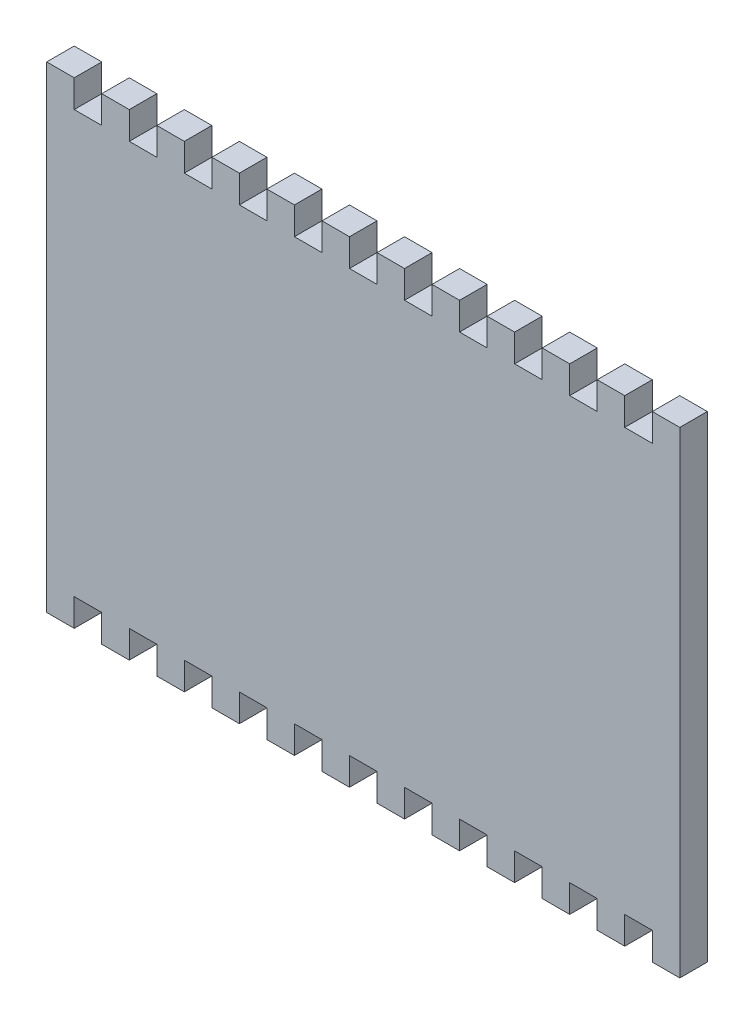
from build123d import *

# Parameters (mm, degrees)
SKETCH1_W                = 150
SKETCH1_H                = 55
BOSS_EXTRUDE1_DEPTH      = 3.175
CUT_EXTRUDE1_REACH       = 81.946
SKETCH2_W                = 3.175
SKETCH2_H                = 6.35
LPATTERN1_COUNT          = 12
LPATTERN1_PITCH          = 6.35
LPATTERN1_COL_COUNT      = 12
LPATTERN1_COL_PITCH      = 6.35
MIRROR1_COPY_1_REACH     = 81.946
MIRROR1_COPY_1_SKETCH_W  = 3.175
MIRROR1_COPY_1_SKETCH_H  = 6.35
MIRROR1_COPY_2_REACH     = 81.946
MIRROR1_COPY_2_SKETCH_W  = 3.175
MIRROR1_COPY_2_SKETCH_H  = 6.35
MIRROR1_COPY_3_REACH     = 81.946
MIRROR1_COPY_3_SKETCH_W  = 3.175
MIRROR1_COPY_3_SKETCH_H  = 6.35
MIRROR1_COPY_4_REACH     = 81.946
MIRROR1_COPY_4_SKETCH_W  = 3.175
MIRROR1_COPY_4_SKETCH_H  = 6.35
MIRROR1_COPY_5_REACH     = 81.946
MIRROR1_COPY_5_SKETCH_W  = 3.175
MIRROR1_COPY_5_SKETCH_H  = 6.35
MIRROR1_COPY_6_REACH     = 81.946
MIRROR1_COPY_6_SKETCH_W  = 3.175
MIRROR1_COPY_6_SKETCH_H  = 6.35
MIRROR1_COPY_7_REACH     = 81.946
MIRROR1_COPY_7_SKETCH_W  = 3.175
MIRROR1_COPY_7_SKETCH_H  = 6.35
MIRROR1_COPY_8_REACH     = 81.946
MIRROR1_COPY_8_SKETCH_W  = 3.175
MIRROR1_COPY_8_SKETCH_H  = 6.35
MIRROR1_COPY_9_REACH     = 81.946
MIRROR1_COPY_9_SKETCH_W  = 3.175
MIRROR1_COPY_9_SKETCH_H  = 6.35
MIRROR1_COPY_10_REACH    = 81.946
MIRROR1_COPY_10_SKETCH_W = 3.175
MIRROR1_COPY_10_SKETCH_H = 6.35
MIRROR1_COPY_11_REACH    = 81.946
MIRROR1_COPY_11_SKETCH_W = 3.175
MIRROR1_COPY_11_SKETCH_H = 6.35
MIRROR1_COPY_12_REACH    = 81.946
MIRROR1_COPY_12_SKETCH_W = 3.175
MIRROR1_COPY_12_SKETCH_H = 6.35
MIRROR1_COPY_13_REACH    = 81.946
MIRROR1_COPY_13_SKETCH_W = 3.175
MIRROR1_COPY_13_SKETCH_H = 6.35
MIRROR1_COPY_14_REACH    = 81.946
MIRROR1_COPY_14_SKETCH_W = 3.175
MIRROR1_COPY_14_SKETCH_H = 6.35
MIRROR1_COPY_15_REACH    = 81.946
MIRROR1_COPY_15_SKETCH_W = 3.175
MIRROR1_COPY_15_SKETCH_H = 6.35
MIRROR1_COPY_16_REACH    = 81.946
MIRROR1_COPY_16_SKETCH_W = 3.175
MIRROR1_COPY_16_SKETCH_H = 6.35
MIRROR1_COPY_17_REACH    = 81.946
MIRROR1_COPY_17_SKETCH_W = 3.175
MIRROR1_COPY_17_SKETCH_H = 6.35
MIRROR1_COPY_18_REACH    = 81.946
MIRROR1_COPY_18_SKETCH_W = 3.175
MIRROR1_COPY_18_SKETCH_H = 6.35
MIRROR1_COPY_19_REACH    = 81.946
MIRROR1_COPY_19_SKETCH_W = 3.175
MIRROR1_COPY_19_SKETCH_H = 6.35
MIRROR1_COPY_20_REACH    = 81.946
MIRROR1_COPY_20_SKETCH_W = 3.175
MIRROR1_COPY_20_SKETCH_H = 6.35
MIRROR1_COPY_21_REACH    = 81.946
MIRROR1_COPY_21_SKETCH_W = 3.175
MIRROR1_COPY_21_SKETCH_H = 6.35
MIRROR1_COPY_22_REACH    = 81.946
MIRROR1_COPY_22_SKETCH_W = 3.175
MIRROR1_COPY_22_SKETCH_H = 6.35
SKETCH3_W                = 19.4375
SKETCH3_H                = 55
CUT_EXTRUDE2_DEPTH       = 10
CUT_EXTRUDE3_DEPTH       = 10
SKETCH6_W                = 15.875
SKETCH6_H                = 3.175
CUT_EXTRUDE4_DEPTH       = 10
SKETCH7_W                = 19.05
SKETCH7_H                = 48.65
CUT_EXTRUDE5_DEPTH       = 10


with BuildPart() as part:
    # Sketch1 → Boss-Extrude1 (new body)
    with BuildSketch(Plane.XY):
        Rectangle(SKETCH1_W, SKETCH1_H)
    extrude(amount=BOSS_EXTRUDE1_DEPTH)

    # Sketch2 → Cut-Extrude1 (cut, up to next)
    with BuildSketch(Plane(origin=(0, 0, 0), x_dir=(-1, 0, 0), z_dir=(0, 0, -1)), mode=Mode.PRIVATE) as cut_extrude1_sk1:
        with Locations((0, 27.5)):
            Rectangle(SKETCH2_W, SKETCH2_H)
    cut_extrude1_tool1 = extrude(cut_extrude1_sk1.sketch, amount=-CUT_EXTRUDE1_REACH, mode=Mode.PRIVATE) & part.part
    cut_extrude1 = cut_extrude1_tool1.solids().sort_by_distance((0, 27.5, 0))[0]
    add(cut_extrude1, mode=Mode.SUBTRACT)

    # LPattern1: Cut-Extrude1 ×12
    with Locations(*[(i * LPATTERN1_PITCH, 0, 0) for i in range(1, LPATTERN1_COUNT)]):
        add(cut_extrude1, mode=Mode.SUBTRACT)

    # LPattern1 col: Cut-Extrude1 ×12
    with Locations(*[(-i * LPATTERN1_COL_PITCH, 0, 0) for i in range(1, LPATTERN1_COL_COUNT)]):
        add(cut_extrude1, mode=Mode.SUBTRACT)

    # Mirror1: Cut-Extrude1 across plane
    add(cut_extrude1.mirror(Plane.ZX), mode=Mode.SUBTRACT)

    # Mirror1 copy 1 sketch → Mirror1 copy 1 (cut, up to next)
    with BuildSketch(Plane(origin=(6.35, 0, 0), x_dir=(-1, 0, 0), z_dir=(0, 0, -1)), mode=Mode.PRIVATE) as mirror1_copy_1_sk1:
        with Locations((0, -27.5)):
            Rectangle(MIRROR1_COPY_1_SKETCH_W, MIRROR1_COPY_1_SKETCH_H)
    mirror1_copy_1_tool1 = extrude(mirror1_copy_1_sk1.sketch, amount=-MIRROR1_COPY_1_REACH, mode=Mode.PRIVATE) & part.part
    add(mirror1_copy_1_tool1.solids().sort_by_distance((6.35, -27.5, 0))[0], mode=Mode.SUBTRACT)

    # Mirror1 copy 2 sketch → Mirror1 copy 2 (cut, up to next)
    with BuildSketch(Plane(origin=(12.7, 0, 0), x_dir=(-1, 0, 0), z_dir=(0, 0, -1)), mode=Mode.PRIVATE) as mirror1_copy_2_sk1:
        with Locations((0, -27.5)):
            Rectangle(MIRROR1_COPY_2_SKETCH_W, MIRROR1_COPY_2_SKETCH_H)
    mirror1_copy_2_tool1 = extrude(mirror1_copy_2_sk1.sketch, amount=-MIRROR1_COPY_2_REACH, mode=Mode.PRIVATE) & part.part
    add(mirror1_copy_2_tool1.solids().sort_by_distance((12.7, -27.5, 0))[0], mode=Mode.SUBTRACT)

    # Mirror1 copy 3 sketch → Mirror1 copy 3 (cut, up to next)
    with BuildSketch(Plane(origin=(19.05, 0, 0), x_dir=(-1, 0, 0), z_dir=(0, 0, -1)), mode=Mode.PRIVATE) as mirror1_copy_3_sk1:
        with Locations((0, -27.5)):
            Rectangle(MIRROR1_COPY_3_SKETCH_W, MIRROR1_COPY_3_SKETCH_H)
    mirror1_copy_3_tool1 = extrude(mirror1_copy_3_sk1.sketch, amount=-MIRROR1_COPY_3_REACH, mode=Mode.PRIVATE) & part.part
    add(mirror1_copy_3_tool1.solids().sort_by_distance((19.05, -27.5, 0))[0], mode=Mode.SUBTRACT)

    # Mirror1 copy 4 sketch → Mirror1 copy 4 (cut, up to next)
    with BuildSketch(Plane(origin=(25.4, 0, 0), x_dir=(-1, 0, 0), z_dir=(0, 0, -1)), mode=Mode.PRIVATE) as mirror1_copy_4_sk1:
        with Locations((0, -27.5)):
            Rectangle(MIRROR1_COPY_4_SKETCH_W, MIRROR1_COPY_4_SKETCH_H)
    mirror1_copy_4_tool1 = extrude(mirror1_copy_4_sk1.sketch, amount=-MIRROR1_COPY_4_REACH, mode=Mode.PRIVATE) & part.part
    add(mirror1_copy_4_tool1.solids().sort_by_distance((25.4, -27.5, 0))[0], mode=Mode.SUBTRACT)

    # Mirror1 copy 5 sketch → Mirror1 copy 5 (cut, up to next)
    with BuildSketch(Plane(origin=(31.75, 0, 0), x_dir=(-1, 0, 0), z_dir=(0, 0, -1)), mode=Mode.PRIVATE) as mirror1_copy_5_sk1:
        with Locations((0, -27.5)):
            Rectangle(MIRROR1_COPY_5_SKETCH_W, MIRROR1_COPY_5_SKETCH_H)
    mirror1_copy_5_tool1 = extrude(mirror1_copy_5_sk1.sketch, amount=-MIRROR1_COPY_5_REACH, mode=Mode.PRIVATE) & part.part
    add(mirror1_copy_5_tool1.solids().sort_by_distance((31.75, -27.5, 0))[0], mode=Mode.SUBTRACT)

    # Mirror1 copy 6 sketch → Mirror1 copy 6 (cut, up to next)
    with BuildSketch(Plane(origin=(38.1, 0, 0), x_dir=(-1, 0, 0), z_dir=(0, 0, -1)), mode=Mode.PRIVATE) as mirror1_copy_6_sk1:
        with Locations((0, -27.5)):
            Rectangle(MIRROR1_COPY_6_SKETCH_W, MIRROR1_COPY_6_SKETCH_H)
    mirror1_copy_6_tool1 = extrude(mirror1_copy_6_sk1.sketch, amount=-MIRROR1_COPY_6_REACH, mode=Mode.PRIVATE) & part.part
    add(mirror1_copy_6_tool1.solids().sort_by_distance((38.1, -27.5, 0))[0], mode=Mode.SUBTRACT)

    # Mirror1 copy 7 sketch → Mirror1 copy 7 (cut, up to next)
    with BuildSketch(Plane(origin=(44.45, 0, 0), x_dir=(-1, 0, 0), z_dir=(0, 0, -1)), mode=Mode.PRIVATE) as mirror1_copy_7_sk1:
        with Locations((0, -27.5)):
            Rectangle(MIRROR1_COPY_7_SKETCH_W, MIRROR1_COPY_7_SKETCH_H)
    mirror1_copy_7_tool1 = extrude(mirror1_copy_7_sk1.sketch, amount=-MIRROR1_COPY_7_REACH, mode=Mode.PRIVATE) & part.part
    add(mirror1_copy_7_tool1.solids().sort_by_distance((44.45, -27.5, 0))[0], mode=Mode.SUBTRACT)

    # Mirror1 copy 8 sketch → Mirror1 copy 8 (cut, up to next)
    with BuildSketch(Plane(origin=(50.8, 0, 0), x_dir=(-1, 0, 0), z_dir=(0, 0, -1)), mode=Mode.PRIVATE) as mirror1_copy_8_sk1:
        with Locations((0, -27.5)):
            Rectangle(MIRROR1_COPY_8_SKETCH_W, MIRROR1_COPY_8_SKETCH_H)
    mirror1_copy_8_tool1 = extrude(mirror1_copy_8_sk1.sketch, amount=-MIRROR1_COPY_8_REACH, mode=Mode.PRIVATE) & part.part
    add(mirror1_copy_8_tool1.solids().sort_by_distance((50.8, -27.5, 0))[0], mode=Mode.SUBTRACT)

    # Mirror1 copy 9 sketch → Mirror1 copy 9 (cut, up to next)
    with BuildSketch(Plane(origin=(57.15, 0, 0), x_dir=(-1, 0, 0), z_dir=(0, 0, -1)), mode=Mode.PRIVATE) as mirror1_copy_9_sk1:
        with Locations((0, -27.5)):
            Rectangle(MIRROR1_COPY_9_SKETCH_W, MIRROR1_COPY_9_SKETCH_H)
    mirror1_copy_9_tool1 = extrude(mirror1_copy_9_sk1.sketch, amount=-MIRROR1_COPY_9_REACH, mode=Mode.PRIVATE) & part.part
    add(mirror1_copy_9_tool1.solids().sort_by_distance((57.15, -27.5, 0))[0], mode=Mode.SUBTRACT)

    # Mirror1 copy 10 sketch → Mirror1 copy 10 (cut, up to next)
    with BuildSketch(Plane(origin=(63.5, 0, 0), x_dir=(-1, 0, 0), z_dir=(0, 0, -1)), mode=Mode.PRIVATE) as mirror1_copy_10_sk1:
        with Locations((0, -27.5)):
            Rectangle(MIRROR1_COPY_10_SKETCH_W, MIRROR1_COPY_10_SKETCH_H)
    mirror1_copy_10_tool1 = extrude(mirror1_copy_10_sk1.sketch, amount=-MIRROR1_COPY_10_REACH, mode=Mode.PRIVATE) & part.part
    add(mirror1_copy_10_tool1.solids().sort_by_distance((63.5, -27.5, 0))[0], mode=Mode.SUBTRACT)

    # Mirror1 copy 11 sketch → Mirror1 copy 11 (cut, up to next)
    with BuildSketch(Plane(origin=(69.85, 0, 0), x_dir=(-1, 0, 0), z_dir=(0, 0, -1)), mode=Mode.PRIVATE) as mirror1_copy_11_sk1:
        with Locations((0, -27.5)):
            Rectangle(MIRROR1_COPY_11_SKETCH_W, MIRROR1_COPY_11_SKETCH_H)
    mirror1_copy_11_tool1 = extrude(mirror1_copy_11_sk1.sketch, amount=-MIRROR1_COPY_11_REACH, mode=Mode.PRIVATE) & part.part
    add(mirror1_copy_11_tool1.solids().sort_by_distance((69.85, -27.5, 0))[0], mode=Mode.SUBTRACT)

    # Mirror1 copy 12 sketch → Mirror1 copy 12 (cut, up to next)
    with BuildSketch(Plane(origin=(-6.35, 0, 0), x_dir=(-1, 0, 0), z_dir=(0, 0, -1)), mode=Mode.PRIVATE) as mirror1_copy_12_sk1:
        with Locations((0, -27.5)):
            Rectangle(MIRROR1_COPY_12_SKETCH_W, MIRROR1_COPY_12_SKETCH_H)
    mirror1_copy_12_tool1 = extrude(mirror1_copy_12_sk1.sketch, amount=-MIRROR1_COPY_12_REACH, mode=Mode.PRIVATE) & part.part
    add(mirror1_copy_12_tool1.solids().sort_by_distance((-6.35, -27.5, 0))[0], mode=Mode.SUBTRACT)

    # Mirror1 copy 13 sketch → Mirror1 copy 13 (cut, up to next)
    with BuildSketch(Plane(origin=(-12.7, 0, 0), x_dir=(-1, 0, 0), z_dir=(0, 0, -1)), mode=Mode.PRIVATE) as mirror1_copy_13_sk1:
        with Locations((0, -27.5)):
            Rectangle(MIRROR1_COPY_13_SKETCH_W, MIRROR1_COPY_13_SKETCH_H)
    mirror1_copy_13_tool1 = extrude(mirror1_copy_13_sk1.sketch, amount=-MIRROR1_COPY_13_REACH, mode=Mode.PRIVATE) & part.part
    add(mirror1_copy_13_tool1.solids().sort_by_distance((-12.7, -27.5, 0))[0], mode=Mode.SUBTRACT)

    # Mirror1 copy 14 sketch → Mirror1 copy 14 (cut, up to next)
    with BuildSketch(Plane(origin=(-19.05, 0, 0), x_dir=(-1, 0, 0), z_dir=(0, 0, -1)), mode=Mode.PRIVATE) as mirror1_copy_14_sk1:
        with Locations((0, -27.5)):
            Rectangle(MIRROR1_COPY_14_SKETCH_W, MIRROR1_COPY_14_SKETCH_H)
    mirror1_copy_14_tool1 = extrude(mirror1_copy_14_sk1.sketch, amount=-MIRROR1_COPY_14_REACH, mode=Mode.PRIVATE) & part.part
    add(mirror1_copy_14_tool1.solids().sort_by_distance((-19.05, -27.5, 0))[0], mode=Mode.SUBTRACT)

    # Mirror1 copy 15 sketch → Mirror1 copy 15 (cut, up to next)
    with BuildSketch(Plane(origin=(-25.4, 0, 0), x_dir=(-1, 0, 0), z_dir=(0, 0, -1)), mode=Mode.PRIVATE) as mirror1_copy_15_sk1:
        with Locations((0, -27.5)):
            Rectangle(MIRROR1_COPY_15_SKETCH_W, MIRROR1_COPY_15_SKETCH_H)
    mirror1_copy_15_tool1 = extrude(mirror1_copy_15_sk1.sketch, amount=-MIRROR1_COPY_15_REACH, mode=Mode.PRIVATE) & part.part
    add(mirror1_copy_15_tool1.solids().sort_by_distance((-25.4, -27.5, 0))[0], mode=Mode.SUBTRACT)

    # Mirror1 copy 16 sketch → Mirror1 copy 16 (cut, up to next)
    with BuildSketch(Plane(origin=(-31.75, 0, 0), x_dir=(-1, 0, 0), z_dir=(0, 0, -1)), mode=Mode.PRIVATE) as mirror1_copy_16_sk1:
        with Locations((0, -27.5)):
            Rectangle(MIRROR1_COPY_16_SKETCH_W, MIRROR1_COPY_16_SKETCH_H)
    mirror1_copy_16_tool1 = extrude(mirror1_copy_16_sk1.sketch, amount=-MIRROR1_COPY_16_REACH, mode=Mode.PRIVATE) & part.part
    add(mirror1_copy_16_tool1.solids().sort_by_distance((-31.75, -27.5, 0))[0], mode=Mode.SUBTRACT)

    # Mirror1 copy 17 sketch → Mirror1 copy 17 (cut, up to next)
    with BuildSketch(Plane(origin=(-38.1, 0, 0), x_dir=(-1, 0, 0), z_dir=(0, 0, -1)), mode=Mode.PRIVATE) as mirror1_copy_17_sk1:
        with Locations((0, -27.5)):
            Rectangle(MIRROR1_COPY_17_SKETCH_W, MIRROR1_COPY_17_SKETCH_H)
    mirror1_copy_17_tool1 = extrude(mirror1_copy_17_sk1.sketch, amount=-MIRROR1_COPY_17_REACH, mode=Mode.PRIVATE) & part.part
    add(mirror1_copy_17_tool1.solids().sort_by_distance((-38.1, -27.5, 0))[0], mode=Mode.SUBTRACT)

    # Mirror1 copy 18 sketch → Mirror1 copy 18 (cut, up to next)
    with BuildSketch(Plane(origin=(-44.45, 0, 0), x_dir=(-1, 0, 0), z_dir=(0, 0, -1)), mode=Mode.PRIVATE) as mirror1_copy_18_sk1:
        with Locations((0, -27.5)):
            Rectangle(MIRROR1_COPY_18_SKETCH_W, MIRROR1_COPY_18_SKETCH_H)
    mirror1_copy_18_tool1 = extrude(mirror1_copy_18_sk1.sketch, amount=-MIRROR1_COPY_18_REACH, mode=Mode.PRIVATE) & part.part
    add(mirror1_copy_18_tool1.solids().sort_by_distance((-44.45, -27.5, 0))[0], mode=Mode.SUBTRACT)

    # Mirror1 copy 19 sketch → Mirror1 copy 19 (cut, up to next)
    with BuildSketch(Plane(origin=(-50.8, 0, 0), x_dir=(-1, 0, 0), z_dir=(0, 0, -1)), mode=Mode.PRIVATE) as mirror1_copy_19_sk1:
        with Locations((0, -27.5)):
            Rectangle(MIRROR1_COPY_19_SKETCH_W, MIRROR1_COPY_19_SKETCH_H)
    mirror1_copy_19_tool1 = extrude(mirror1_copy_19_sk1.sketch, amount=-MIRROR1_COPY_19_REACH, mode=Mode.PRIVATE) & part.part
    add(mirror1_copy_19_tool1.solids().sort_by_distance((-50.8, -27.5, 0))[0], mode=Mode.SUBTRACT)

    # Mirror1 copy 20 sketch → Mirror1 copy 20 (cut, up to next)
    with BuildSketch(Plane(origin=(-57.15, 0, 0), x_dir=(-1, 0, 0), z_dir=(0, 0, -1)), mode=Mode.PRIVATE) as mirror1_copy_20_sk1:
        with Locations((0, -27.5)):
            Rectangle(MIRROR1_COPY_20_SKETCH_W, MIRROR1_COPY_20_SKETCH_H)
    mirror1_copy_20_tool1 = extrude(mirror1_copy_20_sk1.sketch, amount=-MIRROR1_COPY_20_REACH, mode=Mode.PRIVATE) & part.part
    add(mirror1_copy_20_tool1.solids().sort_by_distance((-57.15, -27.5, 0))[0], mode=Mode.SUBTRACT)

    # Mirror1 copy 21 sketch → Mirror1 copy 21 (cut, up to next)
    with BuildSketch(Plane(origin=(-63.5, 0, 0), x_dir=(-1, 0, 0), z_dir=(0, 0, -1)), mode=Mode.PRIVATE) as mirror1_copy_21_sk1:
        with Locations((0, -27.5)):
            Rectangle(MIRROR1_COPY_21_SKETCH_W, MIRROR1_COPY_21_SKETCH_H)
    mirror1_copy_21_tool1 = extrude(mirror1_copy_21_sk1.sketch, amount=-MIRROR1_COPY_21_REACH, mode=Mode.PRIVATE) & part.part
    add(mirror1_copy_21_tool1.solids().sort_by_distance((-63.5, -27.5, 0))[0], mode=Mode.SUBTRACT)

    # Mirror1 copy 22 sketch → Mirror1 copy 22 (cut, up to next)
    with BuildSketch(Plane(origin=(-69.85, 0, 0), x_dir=(-1, 0, 0), z_dir=(0, 0, -1)), mode=Mode.PRIVATE) as mirror1_copy_22_sk1:
        with Locations((0, -27.5)):
            Rectangle(MIRROR1_COPY_22_SKETCH_W, MIRROR1_COPY_22_SKETCH_H)
    mirror1_copy_22_tool1 = extrude(mirror1_copy_22_sk1.sketch, amount=-MIRROR1_COPY_22_REACH, mode=Mode.PRIVATE) & part.part
    add(mirror1_copy_22_tool1.solids().sort_by_distance((-69.85, -27.5, 0))[0], mode=Mode.SUBTRACT)

    # Sketch3 → Cut-Extrude2 (cut)
    with BuildSketch(Plane(origin=(0, 0, 0), x_dir=(-1, 0, 0), z_dir=(0, 0, -1))):
        with Locations((-65.28125, 0)):
            Rectangle(SKETCH3_W, SKETCH3_H)
        with Locations((65.28125, 0)):
            Rectangle(SKETCH3_W, SKETCH3_H)
    extrude(amount=-CUT_EXTRUDE2_DEPTH, mode=Mode.SUBTRACT)

    # Sketch5 → Cut-Extrude3 (cut)
    with BuildSketch(Plane(origin=(0, 0, 0), x_dir=(-1, 0, 0), z_dir=(0, 0, -1))):
        Polygon((-55.5625, 27.5), (-42.8625, 27.5), (-39.6875, 27.5), (-39.6875, 24.325), (-42.8625, 24.325), (-55.5625, 24.325), align=None)
        Polygon((55.5625, 27.5), (42.8625, 27.5), (39.6875, 27.5), (39.6875, 24.325), (42.8625, 24.325), (55.5625, 24.325), align=None)
    extrude(amount=-CUT_EXTRUDE3_DEPTH, mode=Mode.SUBTRACT)

    # Sketch6 → Cut-Extrude4 (cut)
    with BuildSketch(Plane(origin=(0, 0, 0), x_dir=(-1, 0, 0), z_dir=(0, 0, -1))):
        with Locations((-47.625, -25.9125)):
            Rectangle(SKETCH6_W, SKETCH6_H)
        with Locations((47.625, -25.9125)):
            Rectangle(SKETCH6_W, SKETCH6_H)
    extrude(amount=-CUT_EXTRUDE4_DEPTH, mode=Mode.SUBTRACT)

    # Sketch7 → Cut-Extrude5 (cut)
    with BuildSketch(Plane(origin=(0, 0, 0), x_dir=(-1, 0, 0), z_dir=(0, 0, -1))):
        with Locations((-46.0375, 0)):
            Rectangle(SKETCH7_W, SKETCH7_H)
        with Locations((46.0375, 0)):
            Rectangle(SKETCH7_W, SKETCH7_H)
    extrude(amount=-CUT_EXTRUDE5_DEPTH, mode=Mode.SUBTRACT)


solid = part.part
